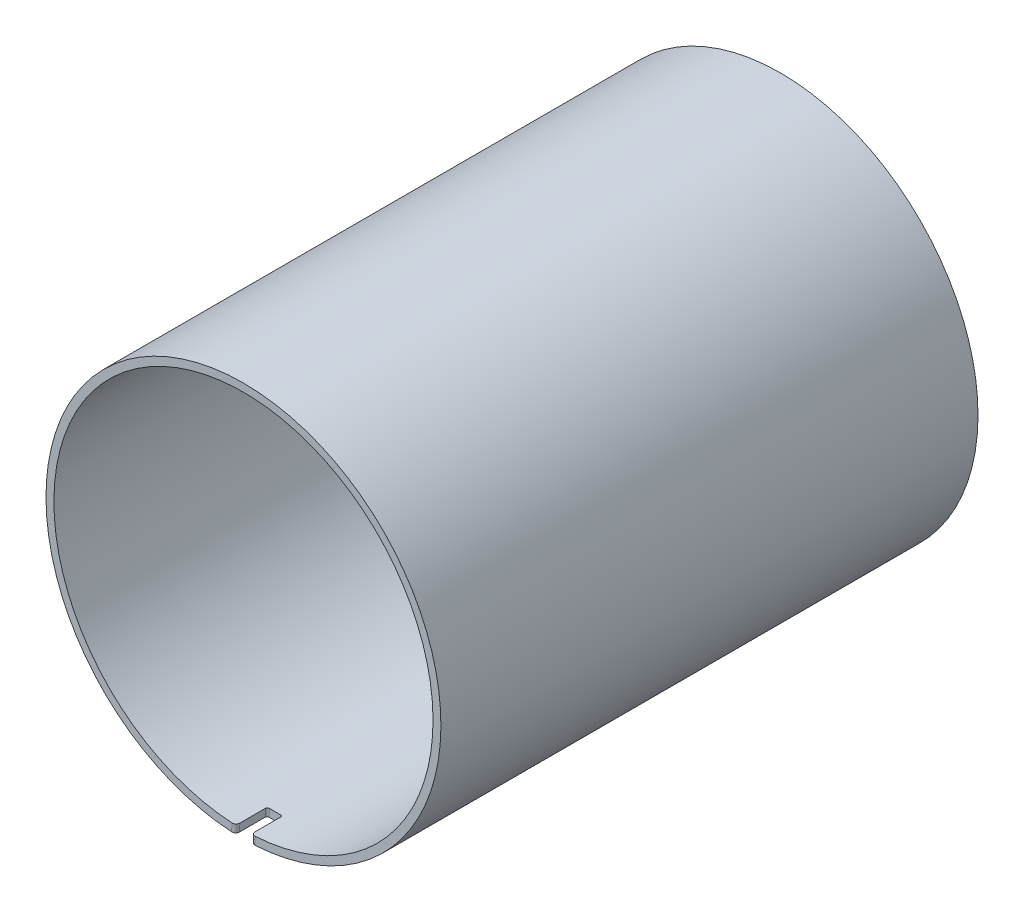
from build123d import *

# Parameters (mm, degrees)
SKETCH_1_R          = 50
SKETCH_1_R_2        = 48
EXTRUDE_1_DEPTH     = 136
CUT_EXTRUDE_START   = -8
CUT_EXTRUDE_1_DEPTH = 8
FILLET_1_R          = 0.5
FILLET_2_R          = 1


with BuildPart() as part:
    # Эскиз1 → Бобышка-Вытянуть1 (new body)
    with BuildSketch(Plane.XY):
        Circle(SKETCH_1_R)
        Circle(SKETCH_1_R_2, mode=Mode.SUBTRACT)
    extrude(amount=EXTRUDE_1_DEPTH)

    # Эскиз3 → Вырез-Вытянуть1 (cut)
    with BuildSketch(Plane.XY.offset(136).offset(CUT_EXTRUDE_START)):
        with BuildLine():
            Line((-1.92, -47.961584628), (-2, -49.959983987))
            ThreePointArc((-2, -49.959983987), (0, -50), (2, -49.959983987))
            Line((2, -49.959983987), (1.92, -47.961584628))
            ThreePointArc((1.92, -47.961584628), (0, -48), (-1.92, -47.961584628))
        make_face()
    cut_extrude_1 = extrude(amount=CUT_EXTRUDE_1_DEPTH, mode=Mode.SUBTRACT)

    # Зеркальное отражение3: Вырез-Вытянуть1 across plane
    add(cut_extrude_1.mirror(Plane.XY.offset(68)), mode=Mode.SUBTRACT)

    # Скругление1
    fillet_1_edges = [part.edges().sort_by_distance(p)[0] for p in [
        (-1.96, -48.960784307, 128),
        (1.96, -48.960784307, 128),
        (1.96, -48.960784307, 8),
        (-1.96, -48.960784307, 8),
    ]]
    fillet(fillet_1_edges, radius=FILLET_1_R)

    # Скругление2
    fillet_2_edges = [part.edges().sort_by_distance(p)[0] for p in [
        (1.96, -48.960784307, 136),
        (-1.96, -48.960784307, 136),
        (1.96, -48.960784307, 0),
        (-1.96, -48.960784307, 0),
    ]]
    fillet(fillet_2_edges, radius=FILLET_2_R)


solid = part.part
